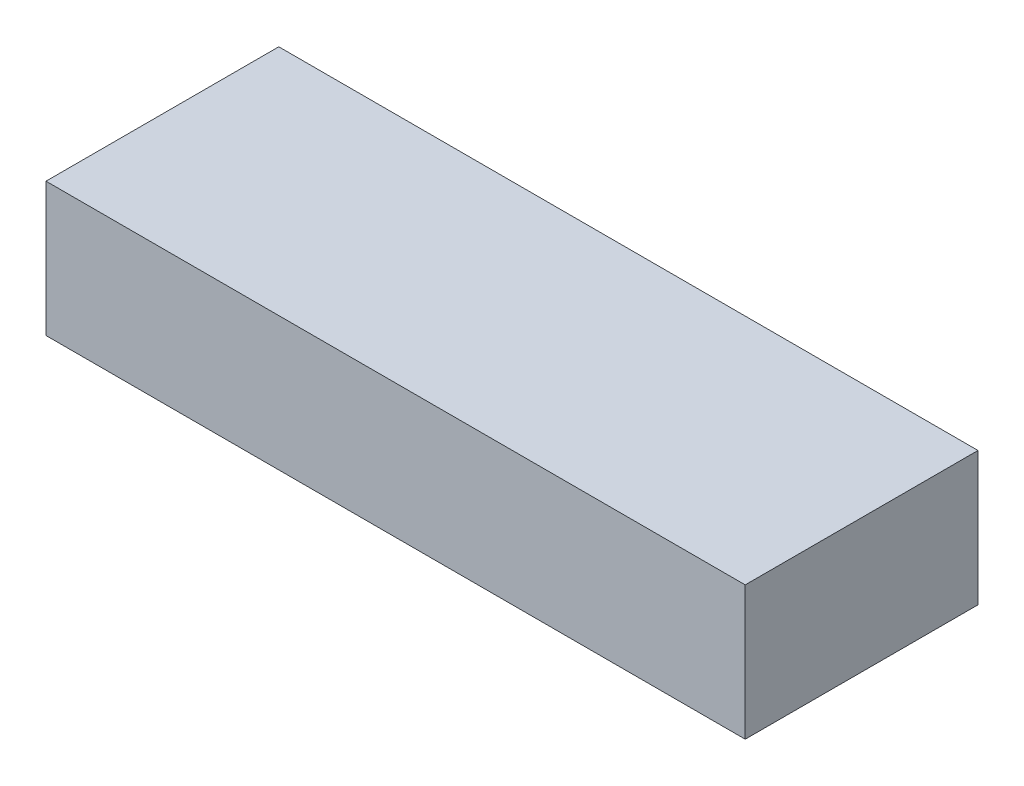
from build123d import *

# Parameters (mm, degrees)
SKIZZE1_W                       = 16.58
SKIZZE1_H                       = 3.17
AUFSATZ_LINEAR_AUSTRAGEN1_DEPTH = 5.52


with BuildPart() as part:
    # Skizze1 → Aufsatz-Linear austragen1 (new body)
    with BuildSketch(Plane.XY):
        with Locations((0.705814691, 4.51725)):
            Rectangle(SKIZZE1_W, SKIZZE1_H)
    extrude(amount=AUFSATZ_LINEAR_AUSTRAGEN1_DEPTH)


solid = part.part
